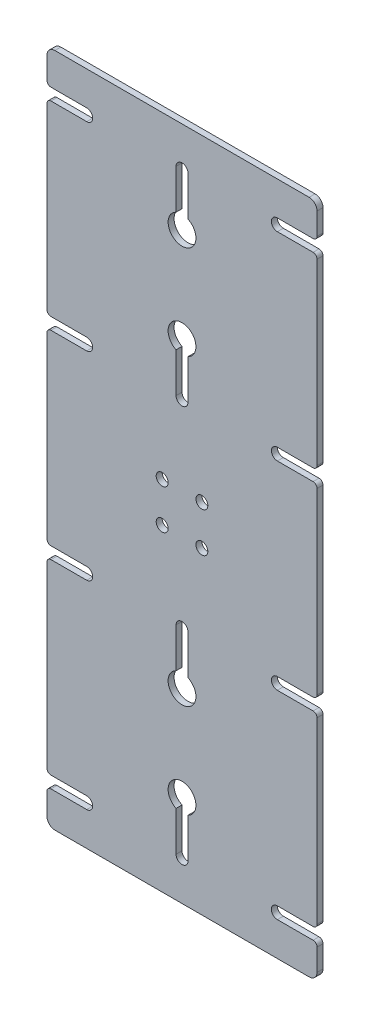
from build123d import *

# Parameters (mm, degrees)
EXTRUDE_1_DEPTH      = 1.5
CUT_EXTRUDE_1_DEPTH  = 1.5
SKETCH_3_R           = 2
CUT_EXTRUDE_2_DEPTH  = 1.5
SKETCH_4_W           = 80
SKETCH_4_H           = 5
EXTRUDE_2_DEPTH      = 1.5
FILLET_1_R           = 2
SKETCH_5_OUTSIDE_W   = 163.618
SKETCH_5_OUTSIDE_H   = 213.618
SKETCH_5_OUTSIDE_W_2 = 80
SKETCH_5_OUTSIDE_H_2 = 170
CUT_EXTRUDE_3_DEPTH  = 193.943644622
SKETCH_6_R           = 1.5
CUT_EXTRUDE_4_DEPTH  = 184.377343202
SKETCH_7_W           = 6
SKETCH_7_H           = 170
CUT_EXTRUDE_5_DEPTH  = 10
FILLET_2_R           = 2
FILLET_3_R           = 1
FILLET_4_R           = 1


with BuildPart() as part:
    # 草图1 → 凸台-拉伸1 (new body)
    with BuildSketch(Plane.XY):
        Polygon((80, 90), (100, 90), (100, 70), (80, 70), (80, 0), (0, 0), (0, 70), (-20, 70), (-20, 90), (0, 90), (0, 160), (80, 160), align=None)
    extrude(amount=EXTRUDE_1_DEPTH)

    # 草图2 → 切除-拉伸1 (cut)
    with BuildSketch(Plane.XY.offset(1.5)):
        with BuildLine():
            Line((64, 153.5), (80, 153.5))
            Line((80, 153.5), (80, 156.5))
            Line((80, 156.5), (64, 156.5))
            ThreePointArc((64, 156.5), (62.5, 155), (64, 153.5))
        make_face()
        with BuildLine():
            Line((38.5, 5), (38.5, 15))
            ThreePointArc((38.5, 15), (40, 21.66227766), (41.5, 15))
            Line((41.5, 15), (41.5, 5))
            ThreePointArc((41.5, 5), (40, 3.5), (38.5, 5))
        make_face()
        with BuildLine():
            Line((16, 153.5), (0, 153.5))
            Line((0, 153.5), (0, 156.5))
            Line((0, 156.5), (16, 156.5))
            ThreePointArc((16, 156.5), (17.5, 155), (16, 153.5))
        make_face()
        with BuildLine():
            Line((64, 103.5), (80, 103.5))
            Line((80, 103.5), (80, 106.5))
            Line((80, 106.5), (64, 106.5))
            ThreePointArc((64, 106.5), (62.5, 105), (64, 103.5))
        make_face()
        with BuildLine():
            Line((16, 106.5), (0, 106.5))
            Line((0, 106.5), (0, 103.5))
            Line((0, 103.5), (16, 103.5))
            ThreePointArc((16, 103.5), (17.5, 105), (16, 106.5))
        make_face()
        with BuildLine():
            Line((16, 56.5), (0, 56.5))
            Line((0, 56.5), (0, 53.5))
            Line((0, 53.5), (16, 53.5))
            ThreePointArc((16, 53.5), (17.5, 55), (16, 56.5))
        make_face()
        with BuildLine():
            Line((64, 53.5), (80, 53.5))
            Line((80, 53.5), (80, 56.5))
            Line((80, 56.5), (64, 56.5))
            ThreePointArc((64, 56.5), (62.5, 55), (64, 53.5))
        make_face()
        with BuildLine():
            Line((16, 6.5), (0, 6.5))
            Line((0, 6.5), (0, 3.5))
            Line((0, 3.5), (16, 3.5))
            ThreePointArc((16, 3.5), (17.5, 5), (16, 6.5))
        make_face()
        with BuildLine():
            Line((64, 6.5), (80, 6.5))
            Line((80, 6.5), (80, 3.5))
            Line((80, 3.5), (64, 3.5))
            ThreePointArc((64, 3.5), (62.5, 5), (64, 6.5))
        make_face()
        with BuildLine():
            Line((38.5, 155), (38.5, 145))
            ThreePointArc((38.5, 145), (40, 138.33772234), (41.5, 145))
            Line((41.5, 145), (41.5, 155))
            ThreePointArc((41.5, 155), (40, 156.5), (38.5, 155))
        make_face()
        with BuildLine():
            Line((41.5, 55), (41.5, 45))
            ThreePointArc((41.5, 45), (40, 38.33772234), (38.5, 45))
            Line((38.5, 45), (38.5, 55))
            ThreePointArc((38.5, 55), (40, 56.5), (41.5, 55))
        make_face()
        with BuildLine():
            Line((38.5, 105), (38.5, 115))
            ThreePointArc((38.5, 115), (40, 121.66227766), (41.5, 115))
            Line((41.5, 115), (41.5, 105))
            ThreePointArc((41.5, 105), (40, 103.5), (38.5, 105))
        make_face()
    extrude(amount=-CUT_EXTRUDE_1_DEPTH, mode=Mode.SUBTRACT)

    # 草图3 → 切除-拉伸2 (cut)
    with BuildSketch(Plane.XY.offset(1.5)):
        with Locations((90, 80)):
            Circle(SKETCH_3_R)
        with Locations((-10, 80)):
            Circle(SKETCH_3_R)
    extrude(amount=-CUT_EXTRUDE_2_DEPTH, mode=Mode.SUBTRACT)

    # 草图4 → 凸台-拉伸2 (add)
    with BuildSketch(Plane(origin=(0, 0, 0), x_dir=(-1, 0, 0), z_dir=(0, 0, -1))):
        with Locations((-40, 162.5)):
            Rectangle(SKETCH_4_W, SKETCH_4_H)
        with Locations((-40, -2.5)):
            Rectangle(SKETCH_4_W, SKETCH_4_H)
    extrude(amount=-EXTRUDE_2_DEPTH)

    # 圆角1
    fillet_1_edges = [part.edges().sort_by_distance(p)[0] for p in [
        (0, 165, 0.75),
        (80, 165, 0.75),
        (0, -5, 0.75),
        (80, -5, 0.75),
    ]]
    fillet(fillet_1_edges, radius=FILLET_1_R)

    # 草图5 outside → 切除-拉伸3 (cut, through all)
    with BuildSketch(Plane.XY.offset(1.5)):
        with Locations((40, 80)):
            Rectangle(SKETCH_5_OUTSIDE_W, SKETCH_5_OUTSIDE_H)
        with Locations((40, 80)):
            Rectangle(SKETCH_5_OUTSIDE_W_2, SKETCH_5_OUTSIDE_H_2, mode=Mode.SUBTRACT)
    extrude(amount=-CUT_EXTRUDE_3_DEPTH, mode=Mode.SUBTRACT)

    # 草图6 → 切除-拉伸4 (cut, through all)
    with BuildSketch(Plane(origin=(0, 0, 0), x_dir=(-1, 0, 0), z_dir=(0, 0, -1))):
        with Locations((-35, 85)):
            Circle(SKETCH_6_R)
        with Locations((-35, 75)):
            Circle(SKETCH_6_R)
        with Locations(Location((-45, 75, 0), (0, 0, 180))):
            Circle(SKETCH_6_R)
        with Locations(Location((-45, 85, 0), (0, 0, 180))):
            Circle(SKETCH_6_R)
    extrude(amount=-CUT_EXTRUDE_4_DEPTH, mode=Mode.SUBTRACT)

    # 草图7 → 切除-拉伸5 (cut)
    with BuildSketch(Plane.XY.offset(1.5)):
        with Locations((3, 80)):
            Rectangle(SKETCH_7_W, SKETCH_7_H)
        with Locations((77, 80)):
            Rectangle(SKETCH_7_W, SKETCH_7_H)
    extrude(amount=-CUT_EXTRUDE_5_DEPTH, mode=Mode.SUBTRACT)

    # 圆角2
    fillet_2_edges = [part.edges().sort_by_distance(p)[0] for p in [
        (6, 165, 0.75),
        (6, -5, 0.75),
        (74, -5, 0.75),
        (74, 165, 0.75),
    ]]
    fillet(fillet_2_edges, radius=FILLET_2_R)

    # 圆角3
    fillet_3_edges = [part.edges().sort_by_distance(p)[0] for p in [
        (6, 156.5, 0.75),
        (6, 153.5, 0.75),
    ]]
    fillet(fillet_3_edges, radius=FILLET_3_R)

    # 圆角4
    fillet_4_edges = [part.edges().sort_by_distance(p)[0] for p in [
        (6, 106.5, 0.75),
        (6, 103.5, 0.75),
        (6, 56.5, 0.75),
        (6, 3.5, 0.75),
        (6, 53.5, 0.75),
        (6, 6.5, 0.75),
        (74, 156.5, 0.75),
        (74, 153.5, 0.75),
        (74, 106.5, 0.75),
        (74, 3.5, 0.75),
        (74, 103.5, 0.75),
        (74, 56.5, 0.75),
        (74, 6.5, 0.75),
        (74, 53.5, 0.75),
    ]]
    fillet(fillet_4_edges, radius=FILLET_4_R)


solid = part.part
